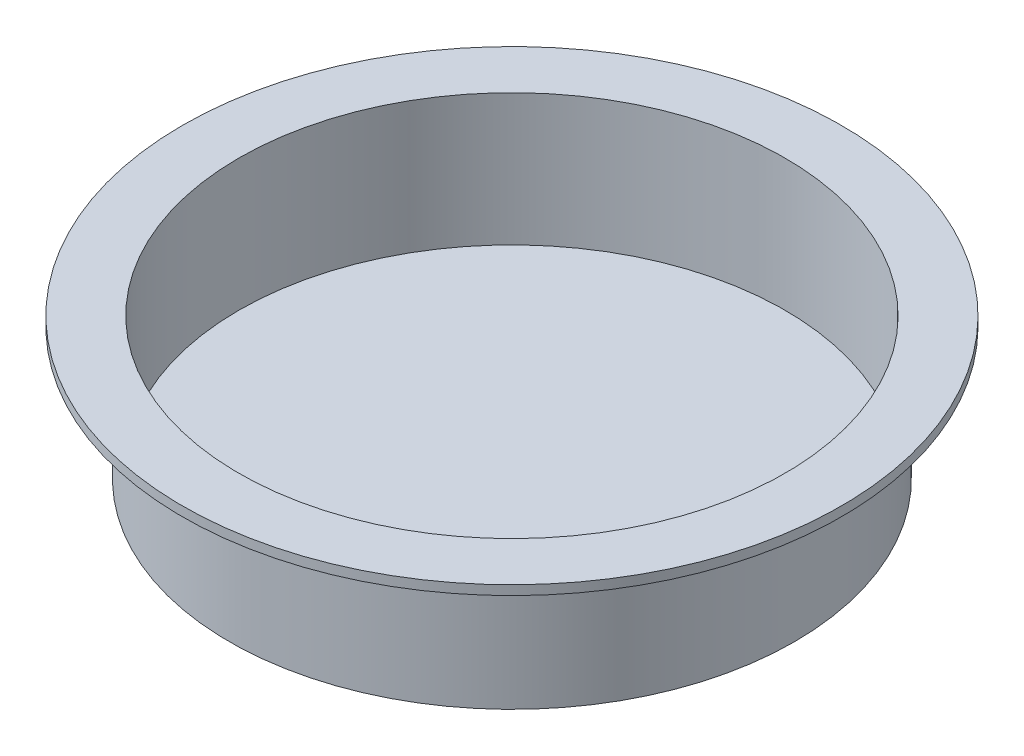
from build123d import *

# Parameters (mm, degrees)
SKETCH4_R          = 36.83
CUT_EXTRUDE1_DEPTH = 17.78


with BuildPart() as part:
    # Sketch3 → Revolve1 (revolve)
    with BuildSketch(Plane.XY, mode=Mode.PRIVATE) as revolve1_sk:
        Polygon((0, 0), (38.1, 0), (38.1, 17.78), (44.45, 17.78), (44.45, 19.05), (0, 19.05), align=None)
    revolve(revolve1_sk.sketch.rotate(Axis((0, 19.05, 0), (0, -1, 0)), 180), axis=Axis((0, 19.05, 0), (0, -1, 0)))

    # Sketch4 → Cut-Extrude1 (cut)
    with BuildSketch(Plane(origin=(0, 19.05, 0), x_dir=(1, 0, 0), z_dir=(0, 1, 0))):
        with Locations(Location((0, 0, 0), (0, 0, 180))):
            Circle(SKETCH4_R)
    extrude(amount=-CUT_EXTRUDE1_DEPTH, mode=Mode.SUBTRACT)


solid = part.part
